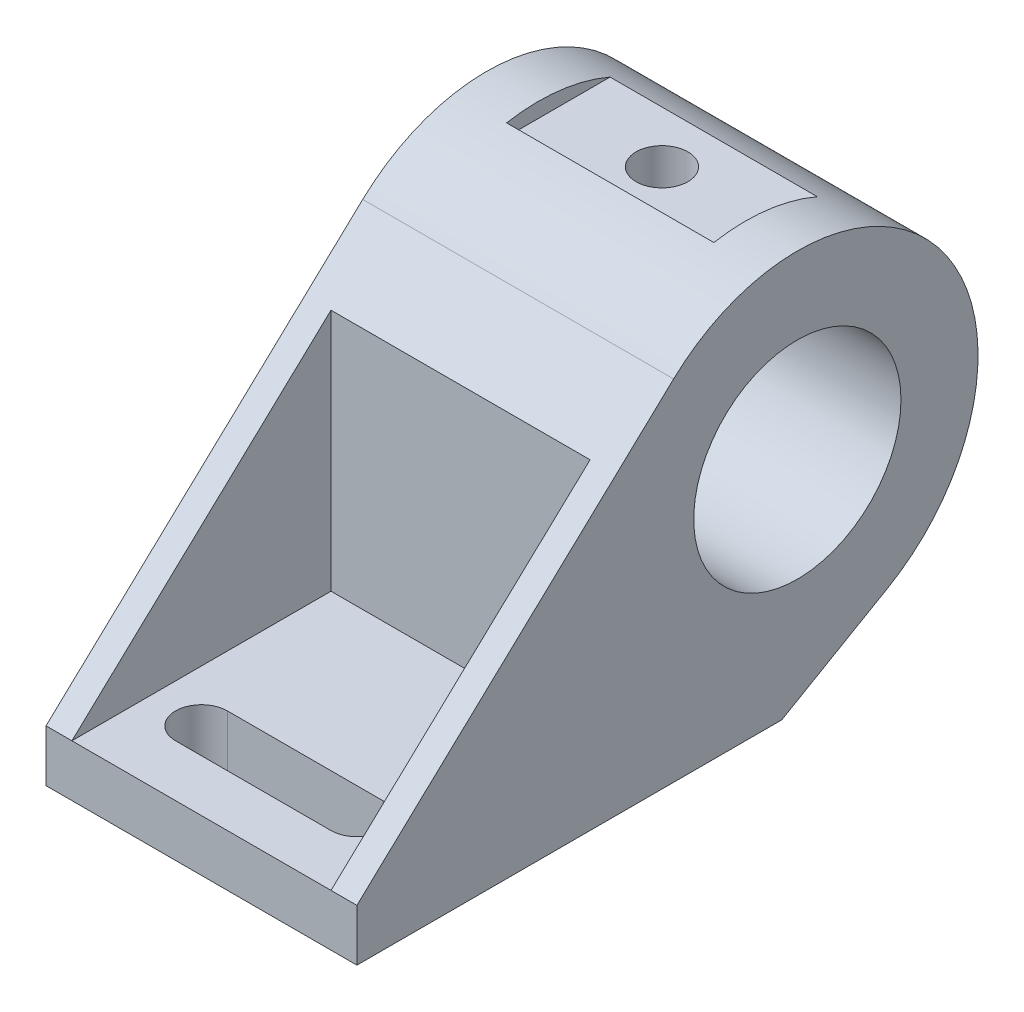
from build123d import *

# Parameters (mm, degrees)
SKETCH2_W               = 60
SKETCH2_H               = 82
BOSS_EXTRUDE2_DEPTH     = 10
SKETCH4_R               = 20
BOSS_EXTRUDE3_DEPTH     = 60
SKETCH8_W               = 50
SKETCH8_H               = 50
CUT_EXTRUDE1_DEPTH      = 50
CUT_EXTRUDE2_DEPTH      = 50
SKETCH14_W              = 40
SKETCH14_H              = 23.219607056
CUT_EXTRUDE3_DEPTH      = 3
CUT_EXTRUDE4_REACH      = 114.236
CUT_EXTRUDE4_END_RADIUS = 20
SKETCH15_R              = 5


with BuildPart() as part:
    # Sketch2 → Boss-Extrude2 (new body)
    with BuildSketch(Plane(origin=(0, 0, 0), x_dir=(1, 0, 0), z_dir=(0, 1, 0))):
        Rectangle(SKETCH2_W, SKETCH2_H)
    extrude(amount=BOSS_EXTRUDE2_DEPTH)

    # Sketch4 → Boss-Extrude3 (add, through all)
    with BuildSketch(Plane(origin=(30, 0, 0), x_dir=(0, 0, -1), z_dir=(1, 0, 0))):
        with BuildLine():
            Line((41, 10), (-41, 10))
            Line((-41, 10), (20.123633203, 67.417511832))
            ThreePointArc((20.123633203, 67.417511832), (71.995026669, 62.794453129), (61.436533479, 11.799038106))
            Line((61.436533479, 11.799038106), (41, 0))
            Line((41, 0), (41, 10))
        make_face()
        with Locations((44, 42)):
            Circle(SKETCH4_R, mode=Mode.SUBTRACT)
    extrude(amount=-BOSS_EXTRUDE3_DEPTH)

    # Sketch8 → Cut-Extrude1 (cut)
    with BuildSketch(Plane(origin=(0, 60, 0), x_dir=(1, 0, 0), z_dir=(0, 1, 0))):
        with Locations((0, -16)):
            Rectangle(SKETCH8_W, SKETCH8_H)
    extrude(amount=-CUT_EXTRUDE1_DEPTH, mode=Mode.SUBTRACT)

    # Sketch9 → Cut-Extrude2 (cut)
    with BuildSketch(Plane(origin=(0, 10, 0), x_dir=(1, 0, 0), z_dir=(0, 1, 0))):
        with BuildLine():
            Line((-15, -21), (15, -21))
            ThreePointArc((15, -21), (20, -26), (15, -31))
            Line((15, -31), (-15, -31))
            ThreePointArc((-15, -31), (-20, -26), (-15, -21))
        make_face()
    extrude(amount=-CUT_EXTRUDE2_DEPTH, mode=Mode.SUBTRACT)

    # Sketch14 → Cut-Extrude3 (cut)
    with BuildSketch(Plane(origin=(0, 77, 0), x_dir=(1, 0, 0), z_dir=(0, 1, 0))):
        with Locations((0, 49.498350081)):
            Rectangle(SKETCH14_W, SKETCH14_H)
    extrude(amount=-CUT_EXTRUDE3_DEPTH, mode=Mode.SUBTRACT)

    # Cut-Extrude4: up to this cylinder (the profile starts outside it)
    cut_extrude4_end = Plane(origin=(0, 42, -44), z_dir=(1, 0, 0)) * Cylinder(CUT_EXTRUDE4_END_RADIUS, 269.472, mode=Mode.PRIVATE)
    # Sketch15 → Cut-Extrude4 (cut, up to the surface)
    with BuildSketch(Plane(origin=(0, 74, 0), x_dir=(1, 0, 0), z_dir=(0, 1, 0)), mode=Mode.PRIVATE) as cut_extrude4_sk1:
        with Locations(Location((0, 47.874836009, 0), (0, 0, 270))):
            Circle(SKETCH15_R)
    cut_extrude4_tool1 = extrude(cut_extrude4_sk1.sketch, amount=-CUT_EXTRUDE4_REACH, mode=Mode.PRIVATE) - cut_extrude4_end
    add(cut_extrude4_tool1.solids().sort_by_distance((0, 74, -47.874836))[0], mode=Mode.SUBTRACT)


solid = part.part
